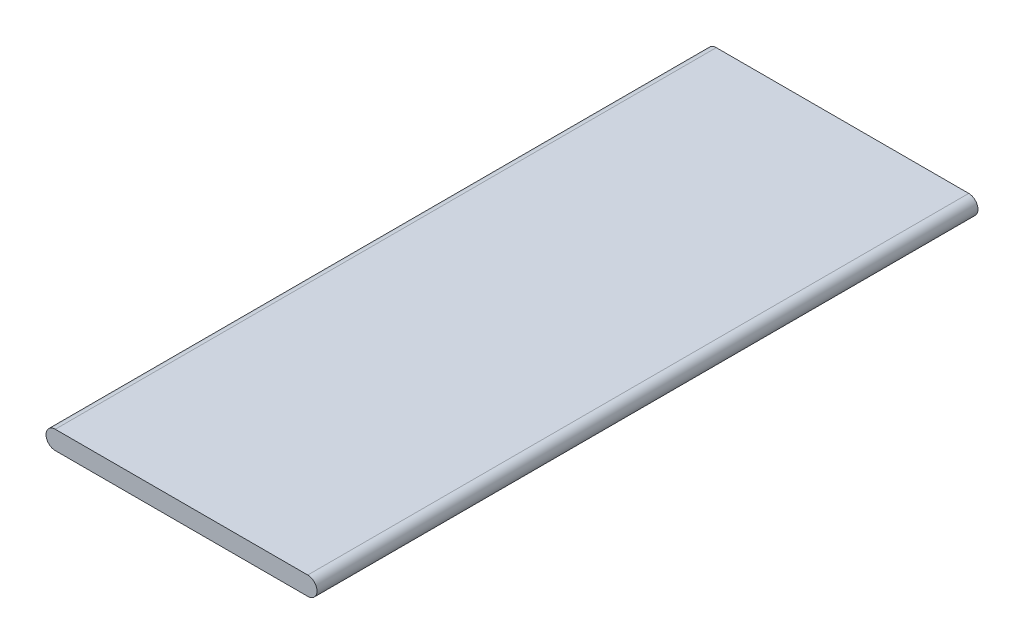
from build123d import *

# Parameters (mm, degrees)
BOSS_EXTRUDE1_DEPTH = 50


with BuildPart() as part:
    # Sketch1 → Boss-Extrude1 (new body)
    with BuildSketch(Plane.XY):
        with BuildLine():
            Line((-5.407246377, 0.7), (13.692753623, 0.7))
            ThreePointArc((13.692753623, 0.7), (14.392753623, 0), (13.692753623, -0.7))
            Line((13.692753623, -0.7), (-5.407246377, -0.7))
            ThreePointArc((-5.407246377, -0.7), (-6.107246377, 0), (-5.407246377, 0.7))
        make_face()
    extrude(amount=BOSS_EXTRUDE1_DEPTH)


solid = part.part
